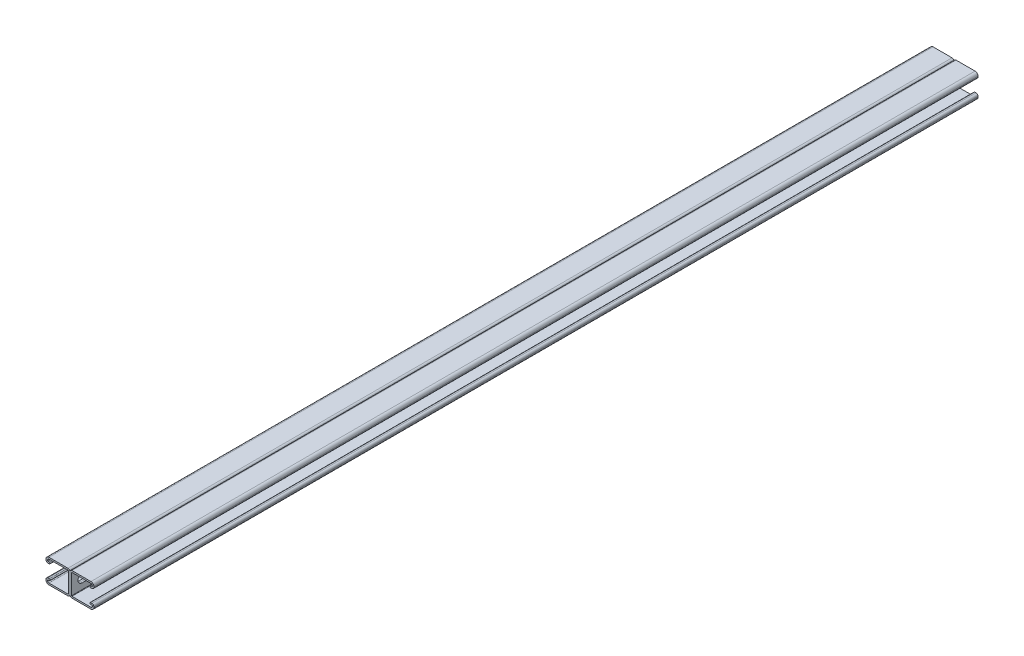
from build123d import *

# Parameters (mm, degrees)
BOSS_EXTRUDE1_DEPTH = 1524
CUT_EXTRUDE1_DEPTH  = 2.794
LPATTERN1_COUNT     = 30
LPATTERN1_PITCH     = 50.8


with BuildPart() as part:
    # Sketch1 → Boss-Extrude1 (new body)
    with BuildSketch(Plane.XY):
        with BuildLine():
            Line((-36.22675, 20.6375), (-3.46075, 20.6375))
            ThreePointArc((-3.46075, 20.6375), (-1.013630207, 19.623869793), (0, 17.17675))
            Line((0, 17.17675), (0, -17.17675))
            ThreePointArc((0, -17.17675), (-1.013630207, -19.623869793), (-3.46075, -20.6375))
            Line((-3.46075, -20.6375), (-36.22675, -20.6375))
            ThreePointArc((-36.22675, -20.6375), (-39.796401808, -19.158901808), (-41.275, -15.58925))
            Line((-41.275, -15.58925), (-41.275, -14.57325))
            ThreePointArc((-41.275, -14.57325), (-40.261369793, -12.126130207), (-37.81425, -11.1125))
            Line((-37.81425, -11.1125), (-35.5346, -11.1125))
            ThreePointArc((-35.5346, -11.1125), (-34.1376, -12.5095), (-35.5346, -13.9065))
            Line((-35.5346, -13.9065), (-37.81425, -13.9065))
            ThreePointArc((-37.81425, -13.9065), (-38.285713446, -14.101786554), (-38.481, -14.57325))
            Line((-38.481, -14.57325), (-38.481, -15.58925))
            ThreePointArc((-38.481, -15.58925), (-37.820745461, -17.183245461), (-36.22675, -17.8435))
            Line((-36.22675, -17.8435), (-3.46075, -17.8435))
            ThreePointArc((-3.46075, -17.8435), (-2.989286554, -17.648213446), (-2.794, -17.17675))
            Line((-2.794, -17.17675), (-2.794, 17.17675))
            ThreePointArc((-2.794, 17.17675), (-2.989286554, 17.648213446), (-3.46075, 17.8435))
            Line((-3.46075, 17.8435), (-36.22675, 17.8435))
            ThreePointArc((-36.22675, 17.8435), (-37.820745461, 17.183245461), (-38.481, 15.58925))
            Line((-38.481, 15.58925), (-38.481, 14.57325))
            ThreePointArc((-38.481, 14.57325), (-38.285713446, 14.101786554), (-37.81425, 13.9065))
            Line((-37.81425, 13.9065), (-35.5346, 13.9065))
            ThreePointArc((-35.5346, 13.9065), (-34.1376, 12.5095), (-35.5346, 11.1125))
            Line((-35.5346, 11.1125), (-37.81425, 11.1125))
            ThreePointArc((-37.81425, 11.1125), (-40.261369793, 12.126130207), (-41.275, 14.57325))
            Line((-41.275, 14.57325), (-41.275, 15.58925))
            ThreePointArc((-41.275, 15.58925), (-39.796401808, 19.158901808), (-36.22675, 20.6375))
        make_face()
    extrude(amount=-BOSS_EXTRUDE1_DEPTH)

    # Sketch2 → Cut-Extrude1 (cut)
    with BuildSketch(Plane(origin=(0, 0, 0), x_dir=(0, 0, -1), z_dir=(1, 0, 0))):
        with BuildLine():
            Line((18.25625, 7.14375), (32.54375, 7.14375))
            ThreePointArc((32.54375, 7.14375), (39.6875, 0), (32.54375, -7.14375))
            Line((32.54375, -7.14375), (18.25625, -7.14375))
            ThreePointArc((18.25625, -7.14375), (11.1125, 0), (18.25625, 7.14375))
        make_face()
    cut_extrude1 = extrude(amount=-CUT_EXTRUDE1_DEPTH, mode=Mode.SUBTRACT)

    # LPattern1: Cut-Extrude1 ×30
    with Locations(*[(0, 0, -i * LPATTERN1_PITCH) for i in range(1, LPATTERN1_COUNT)]):
        add(cut_extrude1, mode=Mode.SUBTRACT)


with BuildPart() as body_2:
    # Mirror1: mirrored copy
    add(part.part.mirror(Plane(origin=(0, 17.17675, -1524), x_dir=(0, 0, 1), z_dir=(1, 0, 0))))


solid = Compound([part.part, body_2.part])
